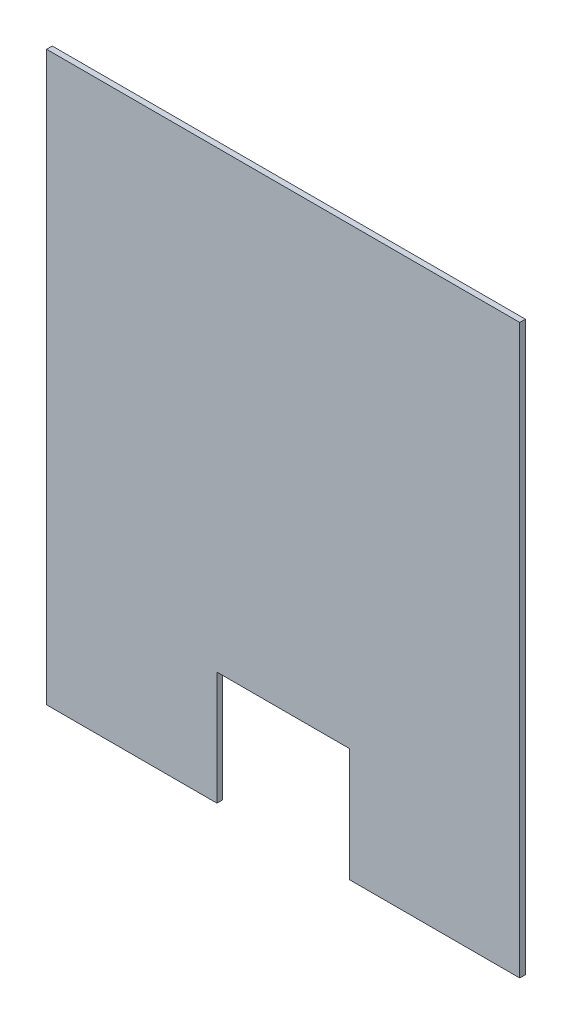
from build123d import *

# Parameters (mm, degrees)
BOSS_EXTRU_1_DEPTH = 3


with BuildPart() as part:
    # Esquisse1 → Boss.-Extru.1 (new body)
    with BuildSketch(Plane.XY):
        Polygon((35, -150), (125, -150), (125, 150), (-125, 150), (-125, -150), (-35, -150), (-35, -90), (35, -90), align=None)
    extrude(amount=BOSS_EXTRU_1_DEPTH)


solid = part.part
